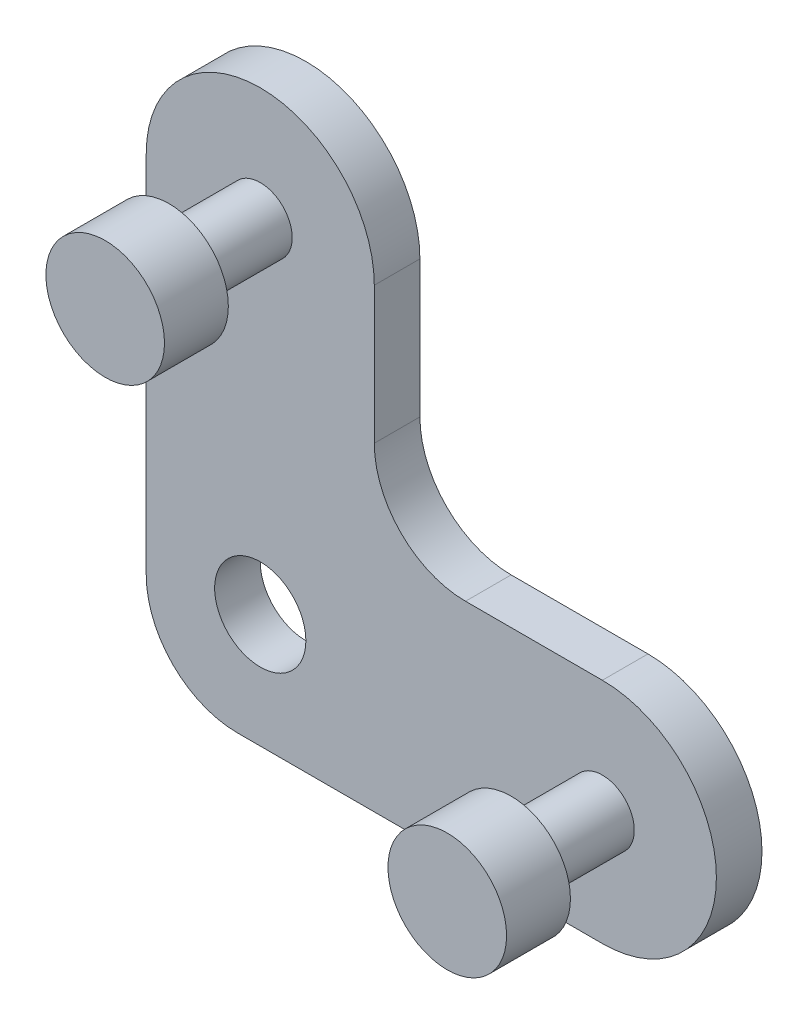
from build123d import *

# Parameters (mm, degrees)
BODY_DEPTH                  = 1.27
SKETCH2_R                   = 0.889
NUBS_DEPTH                  = 2.54
SKETCH3_R                   = 1.651
DON_T_LET_IT_FALL_OFF_DEPTH = 1.778
ATTACH_TO_SIDE_REACH        = 24.862
SKETCH5_R                   = 1.27


with BuildPart() as part:
    # Sketch1 → body (new body)
    with BuildSketch(Plane.XY):
        with BuildLine():
            Line((0, 12.7), (0, 2.54))
            ThreePointArc((0, 2.54), (0.743948776, 0.743948776), (2.54, 0))
            Line((2.54, 0), (12.7, 0))
            ThreePointArc((12.7, 0), (15.875, 3.175), (12.7, 6.35))
            Line((12.7, 6.35), (8.89, 6.35))
            ThreePointArc((8.89, 6.35), (7.093948776, 7.093948776), (6.35, 8.89))
            Line((6.35, 8.89), (6.35, 12.7))
            ThreePointArc((6.35, 12.7), (3.175, 15.875), (0, 12.7))
        make_face()
    extrude(amount=BODY_DEPTH)

    # Sketch2 → nubs (add)
    with BuildSketch(Plane.XY.offset(1.27)):
        with Locations(Location((3.175, 12.7, 0), (0, 0, 180))):
            Circle(SKETCH2_R)
        with Locations(Location((12.7, 3.175, 0), (0, 0, 180))):
            Circle(SKETCH2_R)
    extrude(amount=NUBS_DEPTH)

    # Sketch3 → don't let it fall off (add)
    with BuildSketch(Plane.XY.offset(3.81)):
        with Locations((12.7, 3.175)):
            Circle(SKETCH3_R)
        with Locations((3.175, 12.7)):
            Circle(SKETCH3_R)
    extrude(amount=DON_T_LET_IT_FALL_OFF_DEPTH)

    # Sketch5 → attach to side (cut, up to next)
    with BuildSketch(Plane.XY.offset(1.27), mode=Mode.PRIVATE) as attach_to_side_sk1:
        with Locations((3.175, 3.175)):
            Circle(SKETCH5_R)
    attach_to_side_tool1 = extrude(attach_to_side_sk1.sketch, amount=-ATTACH_TO_SIDE_REACH, mode=Mode.PRIVATE) & part.part
    add(attach_to_side_tool1.solids().sort_by_distance((3.175, 3.175, 1.27))[0], mode=Mode.SUBTRACT)


solid = part.part
